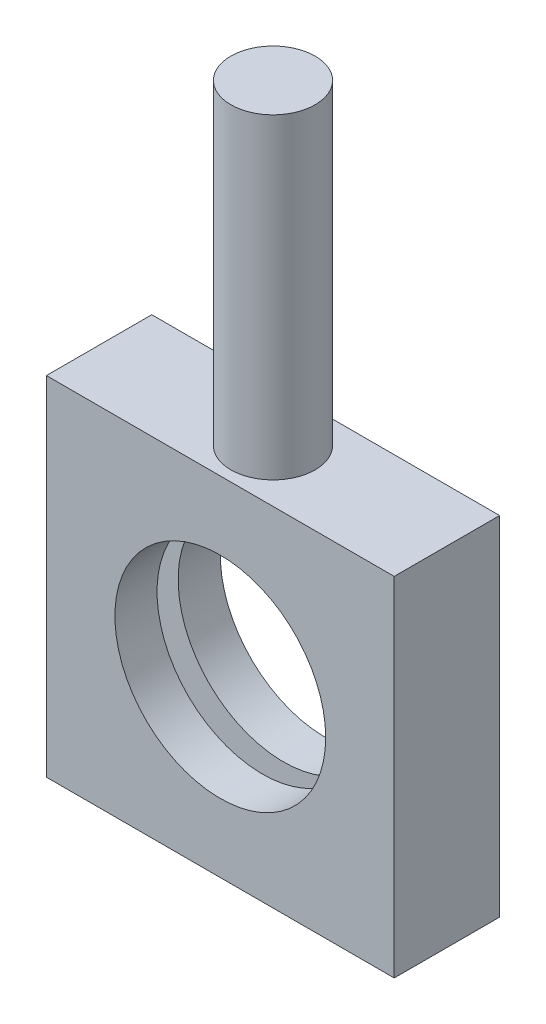
from build123d import *

# Parameters (mm, degrees)
SKETCH1_W                 = 33
SKETCH1_H                 = 33
BOSS_EXTRUDE1_DEPTH       = 10
SHELL1_T                  = -4
SHELL1_THICKNESS_2_FACE_W = 2
SHELL1_THICKNESS_2_FACE_H = 29
SHELL1_THICKNESS_2_DEPTH  = 1.5
SHELL1_THICKNESS_3_FACE_W = 29
SHELL1_THICKNESS_3_FACE_H = 2
SHELL1_THICKNESS_3_DEPTH  = 1.5
SKETCH3_R                 = 10
CUT_EXTRUDE1_DEPTH        = 10
SKETCH5_R                 = 4
BOSS_EXTRUDE2_DEPTH       = 30


with BuildPart() as part:
    # Sketch1 → Boss-Extrude1 (new body)
    with BuildSketch(Plane.XY):
        with Locations((4.463597679, 4.532591876)):
            Rectangle(SKETCH1_W, SKETCH1_H)
    extrude(amount=BOSS_EXTRUDE1_DEPTH)

    # Shell1
    shell1_openings = [part.faces().sort_by_distance(p)[0] for p in [
        (4.463597679, -11.967408124, 5),
    ]]
    offset(amount=SHELL1_T, openings=shell1_openings, kind=Kind.INTERSECTION)

    # Shell1 thickness 2 face (on inner face of the shell) → Shell1 thickness 2 (cut)
    with BuildSketch(Plane(origin=(16.963597679, 2.532591876, 5), x_dir=(0, 0, 1), z_dir=(1, 0, 0))):
        Rectangle(SHELL1_THICKNESS_2_FACE_W, SHELL1_THICKNESS_2_FACE_H)
    extrude(amount=SHELL1_THICKNESS_2_DEPTH, mode=Mode.SUBTRACT)

    # Shell1 thickness 3 face (on inner face of the shell) → Shell1 thickness 3 (cut)
    with BuildSketch(Plane(origin=(-8.036402321, 2.532591876, 5), x_dir=(0, -1, 0), z_dir=(-1, 0, 0))):
        Rectangle(SHELL1_THICKNESS_3_FACE_W, SHELL1_THICKNESS_3_FACE_H)
    extrude(amount=SHELL1_THICKNESS_3_DEPTH, mode=Mode.SUBTRACT)

    # Sketch3 → Cut-Extrude1 (cut)
    with BuildSketch(Plane.XY.offset(10)):
        with Locations((4.463597679, 4.532591876)):
            Circle(SKETCH3_R)
    extrude(amount=-CUT_EXTRUDE1_DEPTH, mode=Mode.SUBTRACT)

    # Sketch5 → Boss-Extrude2 (add)
    with BuildSketch(Plane(origin=(0, 21.032591876, 0), x_dir=(1, 0, 0), z_dir=(0, 1, 0))):
        with Locations(Location((4.463597679, -5, 0), (0, 0, 270))):
            Circle(SKETCH5_R)
    extrude(amount=BOSS_EXTRUDE2_DEPTH)


solid = part.part
